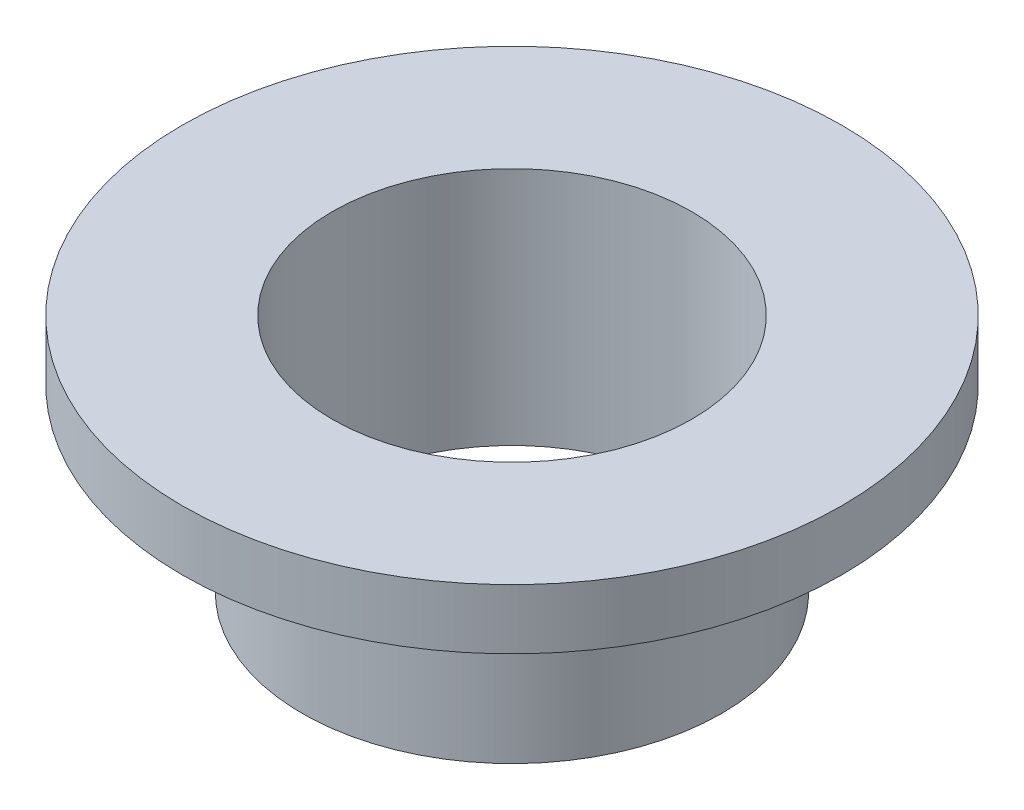
from build123d import *


with BuildPart() as part:
    # Sketch1 → Revolve1 (revolve)
    with BuildSketch(Plane.XY, mode=Mode.PRIVATE) as revolve1_sk:
        Polygon((3, 0), (5.5, 0), (5.5, -1), (3.5, -1), (3.5, -4), (3, -4), align=None)
    revolve(revolve1_sk.sketch.rotate(Axis((0, 0, 0), (0, -1, 0)), 180), axis=Axis((0, 0, 0), (0, -1, 0)))


solid = part.part
